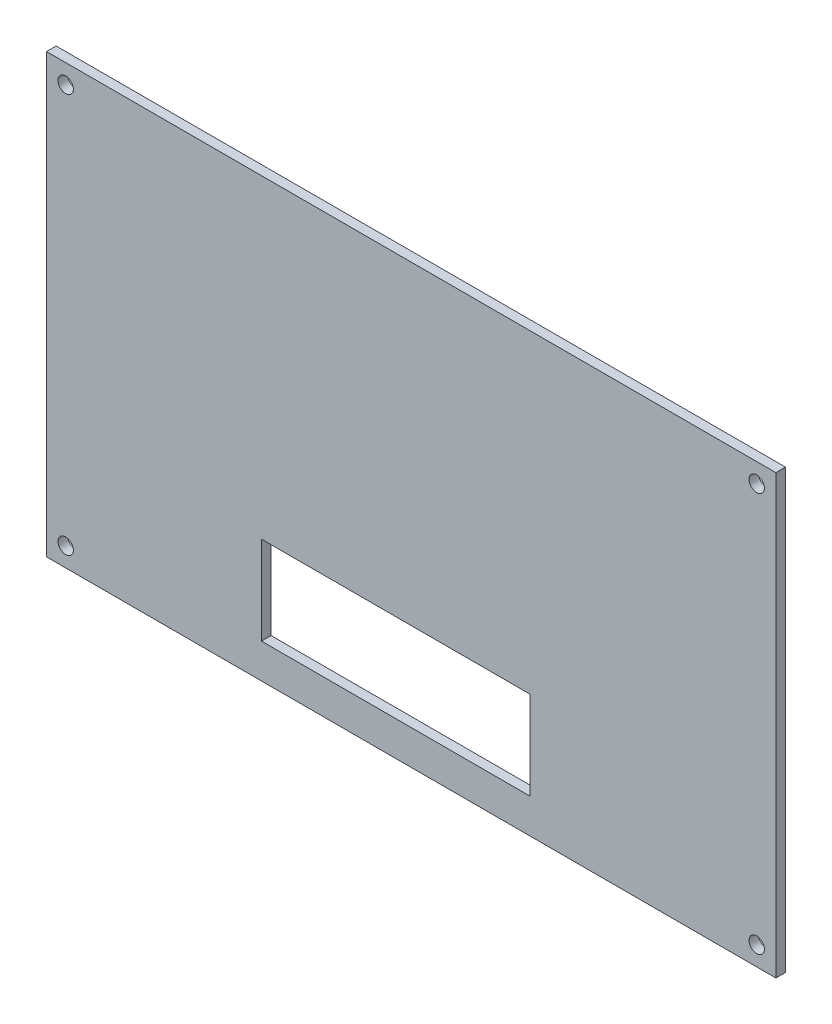
from build123d import *

# Parameters (mm, degrees)
SKETCH1_W           = 190
SKETCH1_H           = 114
BOSS_EXTRUDE1_DEPTH = 2.5
SKETCH3_W           = 70
SKETCH3_H           = 23
CUT_EXTRUDE2_DEPTH  = 10
SKETCH4_R           = 2
CUT_EXTRUDE3_DEPTH  = 10


with BuildPart() as part:
    # Sketch1 → Boss-Extrude1 (new body)
    with BuildSketch(Plane.XY):
        Rectangle(SKETCH1_W, SKETCH1_H)
    extrude(amount=BOSS_EXTRUDE1_DEPTH)

    # Sketch3 → Cut-Extrude2 (cut)
    with BuildSketch(Plane.XY.offset(2.5)):
        with Locations((-4, -36.5)):
            Rectangle(SKETCH3_W, SKETCH3_H)
    extrude(amount=-CUT_EXTRUDE2_DEPTH, mode=Mode.SUBTRACT)

    # Sketch4 → Cut-Extrude3 (cut)
    with BuildSketch(Plane.XY.offset(2.5)):
        with Locations((-90, 52)):
            Circle(SKETCH4_R)
        with Locations(Location((90, 52, 0), (0, 0, 180))):
            Circle(SKETCH4_R)
        with Locations((-90, -52)):
            Circle(SKETCH4_R)
        with Locations(Location((90, -52, 0), (0, 0, 180))):
            Circle(SKETCH4_R)
    extrude(amount=-CUT_EXTRUDE3_DEPTH, mode=Mode.SUBTRACT)


solid = part.part
